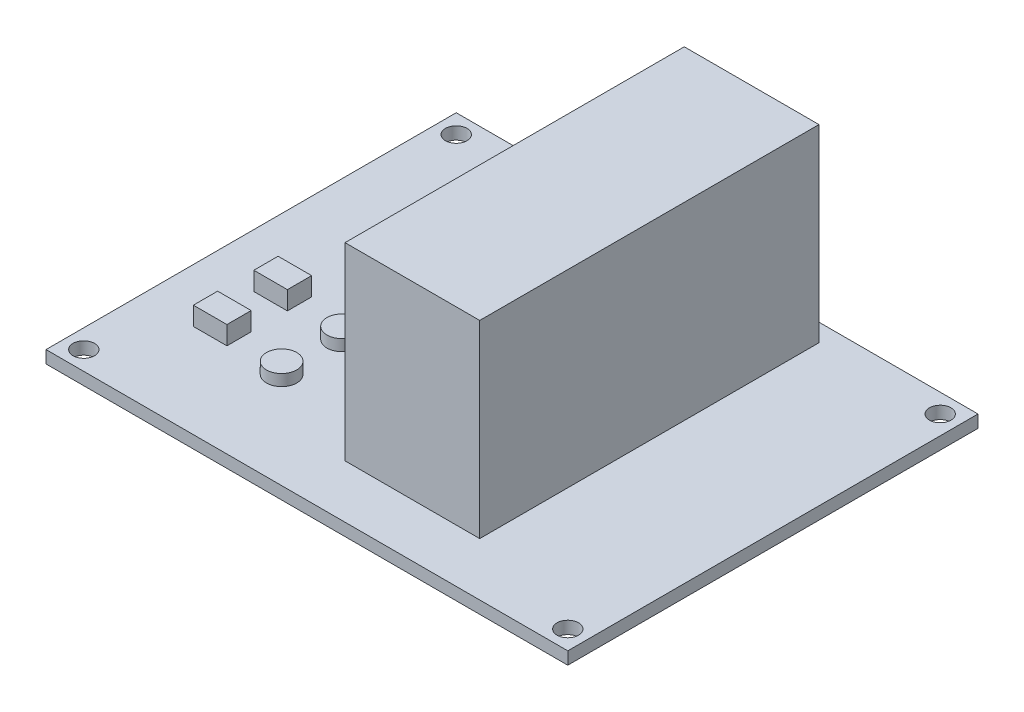
from build123d import *

# Parameters (mm, degrees)
SKETCH1_W             = 69.03
SKETCH1_H             = 54.27
BOSS_EXTRUDE1_DEPTH   = 1.65
SKETCH2_R             = 2
BOSS_EXTRUDE2_DEPTH   = 1.5
SKETCH3_W             = 4.44
SKETCH3_H             = 3.21
BOSS_EXTRUDE3_DEPTH   = 2.44
SKETCH4_W             = 17.82
SKETCH4_H             = 44.88
BOSS_EXTRUDE4_DEPTH   = 25
F_4_CLEARANCE_HOLE1_D = 2.8448


with BuildPart() as part:
    # Sketch1 → Boss-Extrude1 (new body)
    with BuildSketch(Plane(origin=(0, 0, 0), x_dir=(1, 0, 0), z_dir=(0, 1, 0))):
        Rectangle(SKETCH1_W, SKETCH1_H)
    extrude(amount=BOSS_EXTRUDE1_DEPTH)

    # Sketch2 → Boss-Extrude2 (add)
    with BuildSketch(Plane(origin=(0, 1.65, 0), x_dir=(1, 0, 0), z_dir=(0, 1, 0))):
        with Locations(Location((-16.095, -14.385, 0), (0, 0, 90))):
            Circle(SKETCH2_R)
        with Locations(Location((-16.095, -6.385, 0), (0, 0, 90))):
            Circle(SKETCH2_R)
    extrude(amount=BOSS_EXTRUDE2_DEPTH)

    # Sketch3 → Boss-Extrude3 (add)
    with BuildSketch(Plane(origin=(0, 1.65, 0), x_dir=(1, 0, 0), z_dir=(0, 1, 0))):
        with Locations((-25.195, -13.135)):
            Rectangle(SKETCH3_W, SKETCH3_H)
        with Locations((-25.195, -5.135)):
            Rectangle(SKETCH3_W, SKETCH3_H)
    extrude(amount=BOSS_EXTRUDE3_DEPTH)

    # Sketch4 → Boss-Extrude4 (add)
    with BuildSketch(Plane(origin=(0, 1.65, 0), x_dir=(1, 0, 0), z_dir=(0, 1, 0))):
        with Locations((6.925, 2.335)):
            Rectangle(SKETCH4_W, SKETCH4_H)
    extrude(amount=BOSS_EXTRUDE4_DEPTH)

    # #4 Clearance Hole1 (through all)
    with Locations(Plane(origin=(18.660321972, 1.65, 81.830440854), x_dir=(0, 0, 1), z_dir=(0, 1, 0))):
        with Locations((-106.465440854, -50.675321972), (-57.195440854, -50.675321972), (-57.195440854, 13.354678028), (-106.465440854, 13.354678028)):
            Hole(F_4_CLEARANCE_HOLE1_D / 2)


solid = part.part
